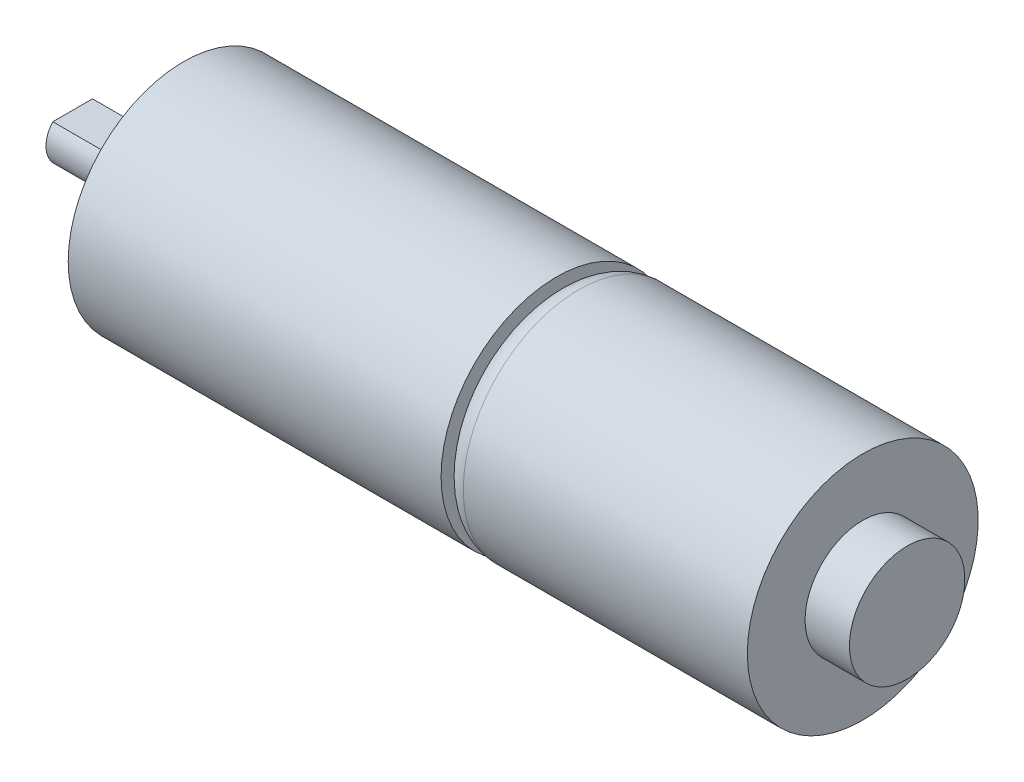
from build123d import *

# Parameters (mm, degrees)
CUT_EXTRUDE_1_DEPTH      = 192.562000407
CUT_EXTRUDE_1_DEPTH_BACK = 192.562000407
SKETCH_2_W               = 15
SKETCH_2_H               = 2
SKETCH_3_R               = 2.25
CUT_EXTRUDE_2_DEPTH      = 10


with BuildPart() as part:
    # 草圖1 → 旋轉1 (revolve)
    with BuildSketch(Plane.XY, mode=Mode.PRIVATE) as revolve_1_sk:
        with BuildLine():
            Line((-188, 0), (-188, 6))
            Line((-188, 6), (-166, 6))
            Line((-166, 6), (-166, 16))
            Line((-166, 16), (-163, 16))
            Line((-163, 16), (-163, 26))
            Line((-163, 26), (-79, 26))
            Line((-79, 26), (-79, 21))
            ThreePointArc((-79, 21), (-77.535533906, 24.535533906), (-74, 26))
            Line((-74, 26), (-10, 26))
            Line((-10, 26), (-10, 13))
            Line((-10, 13), (0, 13))
            Line((0, 13), (0, 0))
            Line((0, 0), (-188, 0))
        make_face()
    revolve(revolve_1_sk.sketch.rotate(Axis((-188, 0, 0), (1, 0, 0)), 90), axis=Axis((-188, 0, 0), (1, 0, 0)))

    # 草圖2 → 伸長1 (cut, two sides: drawn at the far end of the back side and taken through both)
    with BuildSketch(Plane.XY.offset(-CUT_EXTRUDE_1_DEPTH_BACK)):
        with Locations((-180.5, 5)):
            Rectangle(SKETCH_2_W, SKETCH_2_H)
    extrude(amount=CUT_EXTRUDE_1_DEPTH + CUT_EXTRUDE_1_DEPTH_BACK, mode=Mode.SUBTRACT)

    # 草圖3 → 伸長2 (cut)
    with BuildSketch(Plane.ZY.offset(166)):
        with Locations((0, 20)):
            Circle(SKETCH_3_R)
        with Locations((20, 0)):
            Circle(SKETCH_3_R)
        with Locations((0, -20)):
            Circle(SKETCH_3_R)
        with Locations((-20, 0)):
            Circle(SKETCH_3_R)
    extrude(amount=-CUT_EXTRUDE_2_DEPTH, mode=Mode.SUBTRACT)


solid = part.part
